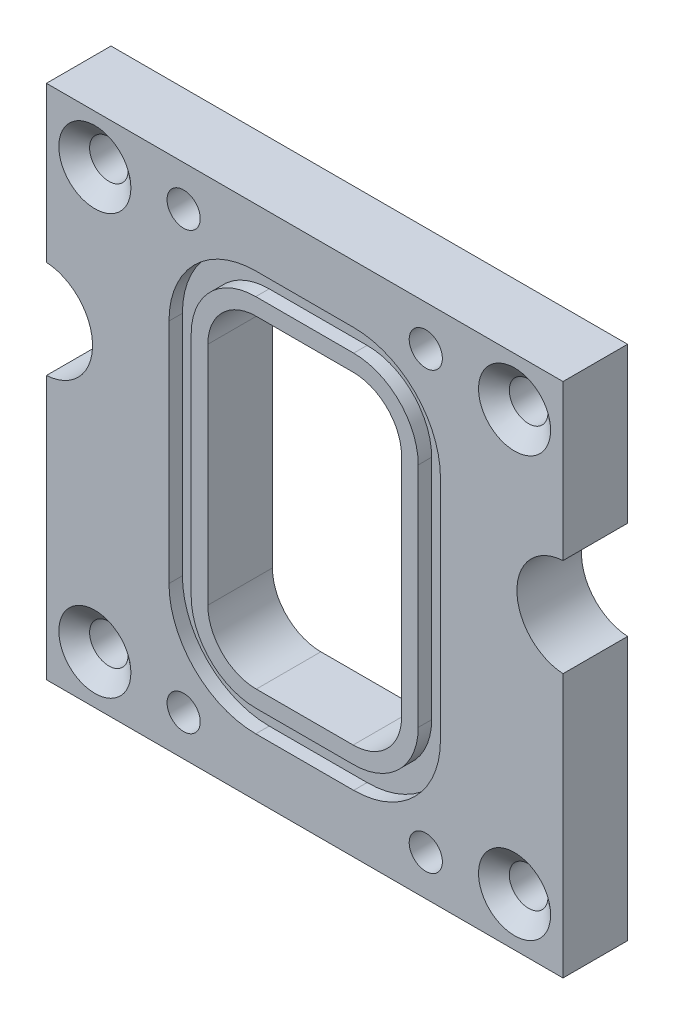
from build123d import *

# Parameters (mm, degrees)
SKETCH1_W                                         = 50.8
SKETCH1_H                                         = 50.8
BOSS_EXTRUDE1_DEPTH                               = 6.35
CUT_EXTRUDE1_DEPTH                                = 37.477972806
CUT_EXTRUDE2_DASH_027_DEPTH                       = 1.3208
CSK_FOR_6_FLAT_HEAD_MACHINE_SCREW_100_D           = 3.7973
CSK_FOR_6_FLAT_HEAD_MACHINE_SCREW_100_CSINK_D     = 7.0866
CSK_FOR_6_FLAT_HEAD_MACHINE_SCREW_100_CSINK_ANGLE = 100
CSK_FOR_4_FLAT_HEAD_MACHINE_SCREW_100_D           = 3.2639
CSK_FOR_4_FLAT_HEAD_MACHINE_SCREW_100_CSINK_D     = 6.477
CSK_FOR_4_FLAT_HEAD_MACHINE_SCREW_100_CSINK_ANGLE = 82
SKETCH8_R                                         = 4.826
CUT_EXTRUDE2_DEPTH                                = 37.477972806


with BuildPart() as part:
    # Sketch1 → Boss-Extrude1 (new body)
    with BuildSketch(Plane.XY):
        Rectangle(SKETCH1_W, SKETCH1_H)
    extrude(amount=BOSS_EXTRUDE1_DEPTH)

    # Sketch2 → Cut-Extrude1 (cut, through all)
    with BuildSketch(Plane.XY.offset(6.35)):
        with BuildLine():
            Line((-4.7625, -15.875), (4.7625, -15.875))
            ThreePointArc((4.7625, -15.875), (8.130096045, -14.480096045), (9.525, -11.1125))
            Line((9.525, -11.1125), (9.525, 11.1125))
            ThreePointArc((9.525, 11.1125), (8.130096045, 14.480096045), (4.7625, 15.875))
            Line((4.7625, 15.875), (-4.7625, 15.875))
            ThreePointArc((-4.7625, 15.875), (-8.130096045, 14.480096045), (-9.525, 11.1125))
            Line((-9.525, 11.1125), (-9.525, -11.1125))
            ThreePointArc((-9.525, -11.1125), (-8.130096045, -14.480096045), (-4.7625, -15.875))
        make_face()
    extrude(amount=-CUT_EXTRUDE1_DEPTH, mode=Mode.SUBTRACT)

    # Sketch3 → Cut-Extrude2 - dash 027 (cut)
    with BuildSketch(Plane.XY.offset(6.35)):
        with BuildLine():
            Line((13.3477, -11.176), (13.3477, 11.176))
            ThreePointArc((13.3477, 11.176), (10.848032113, 17.210732113), (4.8133, 19.7104))
            Line((4.8133, 19.7104), (-4.8133, 19.7104))
            ThreePointArc((-4.8133, 19.7104), (-10.848032113, 17.210732113), (-13.3477, 11.176))
            Line((-13.3477, 11.176), (-13.3477, -11.176))
            ThreePointArc((-13.3477, -11.176), (-10.848032113, -17.210732113), (-4.8133, -19.7104))
            Line((-4.8133, -19.7104), (4.8133, -19.7104))
            ThreePointArc((4.8133, -19.7104), (10.848032113, -17.210732113), (13.3477, -11.176))
        make_face()
        with BuildLine():
            Line((-4.8133, -17.526), (4.8133, -17.526))
            ThreePointArc((4.8133, -17.526), (9.303428061, -15.666128061), (11.1633, -11.176))
            Line((11.1633, -11.176), (11.1633, 11.176))
            ThreePointArc((11.1633, 11.176), (9.303428061, 15.666128061), (4.8133, 17.526))
            Line((4.8133, 17.526), (-4.8133, 17.526))
            ThreePointArc((-4.8133, 17.526), (-9.303428061, 15.666128061), (-11.1633, 11.176))
            Line((-11.1633, 11.176), (-11.1633, -11.176))
            ThreePointArc((-11.1633, -11.176), (-9.303428061, -15.666128061), (-4.8133, -17.526))
        make_face(mode=Mode.SUBTRACT)
    cut_extrude2_dash_027 = extrude(amount=-CUT_EXTRUDE2_DASH_027_DEPTH, mode=Mode.SUBTRACT)

    # CSK for #6 Flat Head Machine Screw (100)1 (through all)
    with Locations(Plane.XY.offset(6.35)):
        with Locations((-20.6375, 20.6375), (20.6375, 20.6375), (20.6375, -20.6375), (-20.6375, -20.6375)):
            CounterSinkHole(CSK_FOR_6_FLAT_HEAD_MACHINE_SCREW_100_D / 2, CSK_FOR_6_FLAT_HEAD_MACHINE_SCREW_100_CSINK_D / 2, counter_sink_angle=CSK_FOR_6_FLAT_HEAD_MACHINE_SCREW_100_CSINK_ANGLE)

    # CSK for #4 Flat Head Machine Screw (100)1 (through all)
    with Locations(Plane(origin=(0, 0, 0), x_dir=(-1, 0, 0), z_dir=(0, 0, -1))):
        with Locations((-11.90625, 21.43125), (11.90625, 21.43125), (-11.90625, -21.43125), (11.90625, -21.43125)):
            CounterSinkHole(CSK_FOR_4_FLAT_HEAD_MACHINE_SCREW_100_D / 2, CSK_FOR_4_FLAT_HEAD_MACHINE_SCREW_100_CSINK_D / 2, counter_sink_angle=CSK_FOR_4_FLAT_HEAD_MACHINE_SCREW_100_CSINK_ANGLE)

    # Mirror1: Cut-Extrude2 - dash 027 across plane
    add(cut_extrude2_dash_027.mirror(Plane(origin=(0, 0, 3.175), x_dir=(1, 0, 0), z_dir=(0, 0, -1))), mode=Mode.SUBTRACT)

    # Sketch8 → Cut-Extrude2 (cut, through all)
    with BuildSketch(Plane.XY.offset(6.35)):
        with Locations((-25.6921, 5.334)):
            Circle(SKETCH8_R)
    cut_extrude2 = extrude(amount=-CUT_EXTRUDE2_DEPTH, mode=Mode.SUBTRACT)

    # Mirror2: Cut-Extrude2 across plane
    add(cut_extrude2.mirror(Plane(origin=(0, 0, 0), x_dir=(0, 0, 1), z_dir=(1, 0, 0))), mode=Mode.SUBTRACT)


solid = part.part
